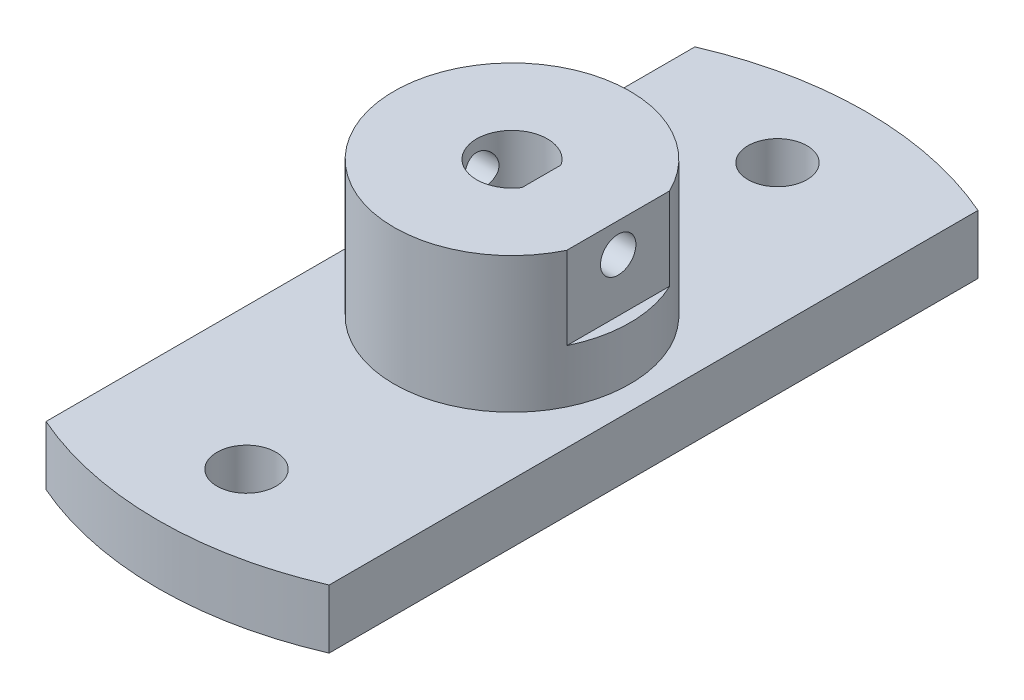
from build123d import *
from build123d.topology import SkipClean

# Parameters (mm, degrees)
SKETCH_1_R          = 2.5
EXTRUDE_1_DEPTH     = 5
SKETCH_2_R          = 10
EXTRUDE_2_DEPTH     = 11.5
CUT_EXTRUDE_START   = -7
CUT_EXTRUDE_1_DEPTH = 7
CUT_EXTRUDE_2_DEPTH = 11.5
SKETCH_5_R          = 3
CUT_EXTRUDE_3_DEPTH = 11.5
SKETCH_6_R          = 1.5
CUT_EXTRUDE_4_DEPTH = 41.165283517


with BuildPart() as part:
    # 草图1 → 凸台-拉伸1 (new body)
    with BuildSketch(Plane(origin=(0, 0, 0), x_dir=(1, 0, 0), z_dir=(0, 1, 0))):
        with BuildLine():
            Line((12, 27.49545417), (12, -27.49545417))
            ThreePointArc((12, -27.49545417), (0, -30), (-12, -27.49545417))
            Line((-12, -27.49545417), (-12, 27.49545417))
            ThreePointArc((-12, 27.49545417), (0, 30), (12, 27.49545417))
        make_face()
        with Locations(Location((0, 22.5, 0), (0, 0, 270))):
            Circle(SKETCH_1_R, mode=Mode.SUBTRACT)
        with Locations(Location((0, -22.5, 0), (0, 0, 270))):
            Circle(SKETCH_1_R, mode=Mode.SUBTRACT)
    extrude(amount=EXTRUDE_1_DEPTH)

    # 草图2 → 凸台-拉伸2 (add)
    with BuildSketch(Plane(origin=(0, 5, 0), x_dir=(1, 0, 0), z_dir=(0, 1, 0))):
        with Locations(Location((0, 0, 0), (0, 0, 270))):
            Circle(SKETCH_2_R)
    extrude(amount=EXTRUDE_2_DEPTH)

    # 草图3 → 切除-拉伸1 (cut)
    with BuildSketch(Plane(origin=(0, 16.5, 0), x_dir=(1, 0, 0), z_dir=(0, 1, 0)).offset(CUT_EXTRUDE_START)):
        with BuildLine():
            Line((9, 4.358898944), (9, -4.358898944))
            ThreePointArc((9, -4.358898944), (10, 0), (9, 4.358898944))
        make_face()
    extrude(amount=CUT_EXTRUDE_1_DEPTH, mode=Mode.SUBTRACT)

    # 草图4 → 切除-拉伸2 (cut)
    with BuildSketch(Plane(origin=(0, 16.5, 0), x_dir=(1, 0, 0), z_dir=(0, 1, 0))):
        with BuildLine():
            Line((2.5, 1.658312395), (2.5, -1.658312395))
            ThreePointArc((2.5, -1.658312395), (-3, 0), (2.5, 1.658312395))
        make_face()
    extrude(amount=-CUT_EXTRUDE_2_DEPTH, mode=Mode.SUBTRACT)

    # 草图5 → 切除-拉伸3 (cut)
    with SkipClean():  # the faces are left unmerged after this step: merging them gives an invalid solid
        with BuildSketch(Plane(origin=(0, 5, 0), x_dir=(1, 0, 0), z_dir=(0, 1, 0))):
            with Locations(Location((0, 0, 0), (0, 0, 270))):
                Circle(SKETCH_5_R)
        extrude(amount=-CUT_EXTRUDE_3_DEPTH, mode=Mode.SUBTRACT)

    # 草图6 → 切除-拉伸4 (cut, through all)
    with SkipClean():  # the faces are left unmerged after this step: merging them gives an invalid solid
        with BuildSketch(Plane(origin=(9, 0, 0), x_dir=(0, 0, -1), z_dir=(1, 0, 0))):
            with Locations((0, 14)):
                Circle(SKETCH_6_R)
        extrude(amount=-CUT_EXTRUDE_4_DEPTH, mode=Mode.SUBTRACT)


solid = part.part
